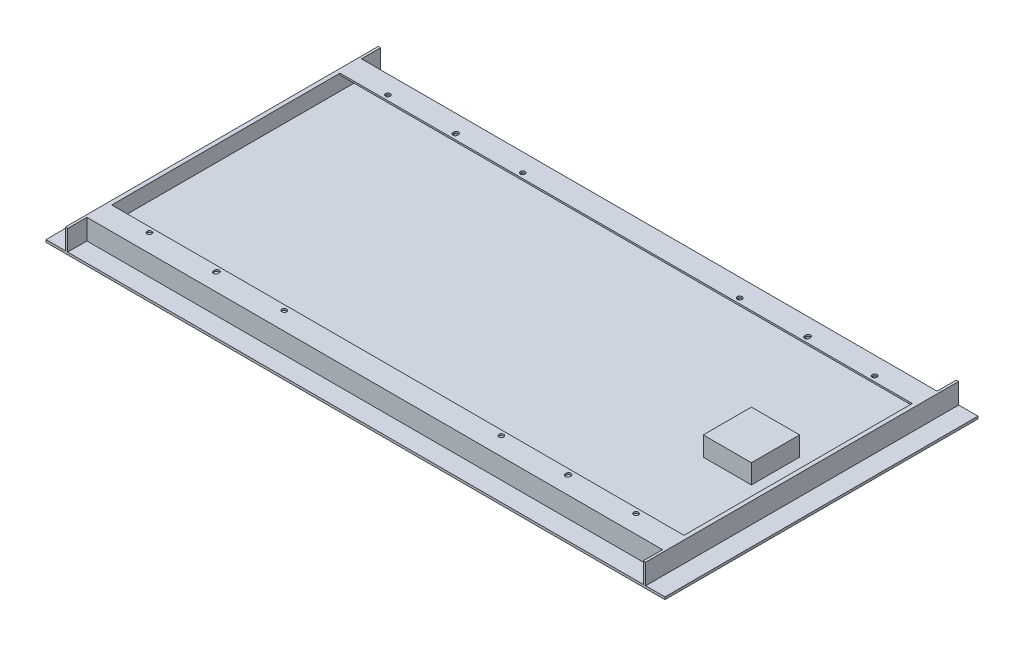
from build123d import *

# Parameters (mm, degrees)
SKETCH1_W            = 754.38
SKETCH1_H            = 351.155
BOSS_EXTRUDE1_DEPTH  = 9.525
SKETCH5_W            = 355.6
SKETCH5_H            = 30.1625
BOSS_EXTRUDE4_DEPTH  = 2.2225
SKETCH6_W            = 754.38
SKETCH6_H            = 30.1625
BOSS_EXTRUDE5_DEPTH  = 2.2225
SKETCH8_W            = 754.38
SKETCH8_H            = 30.1625
BOSS_EXTRUDE6_DEPTH  = 2.2225
SKETCH14_W           = 355.6
SKETCH14_H           = 30.1625
BOSS_EXTRUDE7_DEPTH  = 2.2225
SKETCH16_W           = 754.38
SKETCH16_H           = 2.2225
BOSS_EXTRUDE8_DEPTH  = 25.0825
SKETCH17_W           = 754.38
SKETCH17_H           = 2.2225
BOSS_EXTRUDE9_DEPTH  = 25.0825
CUT_EXTRUDE1_DEPTH   = 2.2225
SKETCH21_R           = 3.175
CUT_EXTRUDE3_DEPTH   = 2.2225
SKETCH22_W           = 758.825
SKETCH22_H           = 30.1625
BOSS_EXTRUDE10_DEPTH = 3.175
SKETCH23_W           = 758.825
SKETCH23_H           = 3.175
BOSS_EXTRUDE11_DEPTH = 25.4
SKETCH24_W           = 758.825
SKETCH24_H           = 30.1625
BOSS_EXTRUDE12_DEPTH = 3.175
SKETCH25_W           = 758.825
SKETCH25_H           = 3.175
BOSS_EXTRUDE13_DEPTH = 25.4
SKETCH26_W           = 412.75
SKETCH26_H           = 30.1625
BOSS_EXTRUDE14_DEPTH = 3.175
SKETCH27_W           = 412.75
SKETCH27_H           = 3.175
BOSS_EXTRUDE15_DEPTH = 25.4
SKETCH28_W           = 412.75
SKETCH28_H           = 30.1625
BOSS_EXTRUDE16_DEPTH = 3.175
SKETCH29_W           = 412.75
SKETCH29_H           = 3.175
BOSS_EXTRUDE17_DEPTH = 25.4
SKETCH30_W           = 63.5
SKETCH30_H           = 63.5
BOSS_EXTRUDE18_DEPTH = 25.4


with BuildPart() as part:
    # Sketch1 → Boss-Extrude1 (new body)
    with BuildSketch(Plane(origin=(0, 0, 0), x_dir=(1, 0, 0), z_dir=(0, 1, 0))):
        Rectangle(SKETCH1_W, SKETCH1_H)
    extrude(amount=BOSS_EXTRUDE1_DEPTH)

    # Sketch5 → Boss-Extrude4 (add)
    with BuildSketch(Plane.ZY.offset(377.19)):
        with Locations((0, 15.08125)):
            Rectangle(SKETCH5_W, SKETCH5_H)
    extrude(amount=BOSS_EXTRUDE4_DEPTH)

    # Sketch6 → Boss-Extrude5 (add)
    with BuildSketch(Plane.XY.offset(175.5775)):
        with Locations((0, 15.08125)):
            Rectangle(SKETCH6_W, SKETCH6_H)
    extrude(amount=BOSS_EXTRUDE5_DEPTH)

    # Sketch8 → Boss-Extrude6 (add)
    with BuildSketch(Plane(origin=(0, 0, -175.5775), x_dir=(-1, 0, 0), z_dir=(0, 0, -1))):
        with Locations((0, 15.08125)):
            Rectangle(SKETCH8_W, SKETCH8_H)
    extrude(amount=BOSS_EXTRUDE6_DEPTH)

    # Sketch14 → Boss-Extrude7 (add)
    with BuildSketch(Plane(origin=(377.19, 0, 0), x_dir=(0, 0, -1), z_dir=(1, 0, 0))):
        with Locations((0, 15.08125)):
            Rectangle(SKETCH14_W, SKETCH14_H)
    extrude(amount=BOSS_EXTRUDE7_DEPTH)

    # Sketch16 → Boss-Extrude8 (add)
    with BuildSketch(Plane.XY.offset(-175.5775)):
        with Locations((0, 29.05125)):
            Rectangle(SKETCH16_W, SKETCH16_H)
    extrude(amount=BOSS_EXTRUDE8_DEPTH)

    # Sketch17 → Boss-Extrude9 (add)
    with BuildSketch(Plane(origin=(0, 0, 175.5775), x_dir=(-1, 0, 0), z_dir=(0, 0, -1))):
        with Locations((0, 29.05125)):
            Rectangle(SKETCH17_W, SKETCH17_H)
    extrude(amount=BOSS_EXTRUDE9_DEPTH)

    # Sketch19 → Cut-Extrude1 (cut)
    with BuildSketch(Plane(origin=(0, 30.1625, 0), x_dir=(1, 0, 0), z_dir=(0, 1, 0))):
        with BuildLine():
            Line((-228.727, 157.1625), (-228.727, 158.4325))
            ThreePointArc((-228.727, 158.4325), (-231.902, 161.6075), (-235.077, 158.4325))
            Line((-235.077, 158.4325), (-235.077, 157.1625))
            ThreePointArc((-235.077, 157.1625), (-231.902, 153.9875), (-228.727, 157.1625))
        make_face()
        with BuildLine():
            Line((-235.077, -158.4325), (-235.077, -157.1625))
            ThreePointArc((-235.077, -157.1625), (-231.902, -153.9875), (-228.727, -157.1625))
            Line((-228.727, -157.1625), (-228.727, -158.4325))
            ThreePointArc((-228.727, -158.4325), (-231.902, -161.6075), (-235.077, -158.4325))
        make_face()
        with BuildLine():
            Line((228.727, -157.1625), (228.727, -158.4325))
            ThreePointArc((228.727, -158.4325), (231.902, -161.6075), (235.077, -158.4325))
            Line((235.077, -158.4325), (235.077, -157.1625))
            ThreePointArc((235.077, -157.1625), (231.902, -153.9875), (228.727, -157.1625))
        make_face()
        with BuildLine():
            Line((228.727, 157.1625), (228.727, 158.4325))
            ThreePointArc((228.727, 158.4325), (231.902, 161.6075), (235.077, 158.4325))
            Line((235.077, 158.4325), (235.077, 157.1625))
            ThreePointArc((235.077, 157.1625), (231.902, 153.9875), (228.727, 157.1625))
        make_face()
    extrude(amount=-CUT_EXTRUDE1_DEPTH, mode=Mode.SUBTRACT)

    # Sketch21 → Cut-Extrude3 (cut)
    with BuildSketch(Plane(origin=(0, 30.1625, 0), x_dir=(1, 0, 0), z_dir=(0, 1, 0))):
        with Locations(Location((-143.002, -157.1625, 0), (0, 0, 270))):
            Circle(SKETCH21_R)
        with Locations(Location((-143.002, 157.1625, 0), (0, 0, 270))):
            Circle(SKETCH21_R)
        with Locations(Location((-320.802, -157.1625, 0), (0, 0, 270))):
            Circle(SKETCH21_R)
        with Locations(Location((-320.802, 157.1625, 0), (0, 0, 270))):
            Circle(SKETCH21_R)
        with Locations(Location((143.002, 157.1625, 0), (0, 0, 270))):
            Circle(SKETCH21_R)
        with Locations(Location((320.802, 157.1625, 0), (0, 0, 270))):
            Circle(SKETCH21_R)
        with Locations(Location((143.002, -157.1625, 0), (0, 0, 270))):
            Circle(SKETCH21_R)
        with Locations(Location((320.802, -157.1625, 0), (0, 0, 270))):
            Circle(SKETCH21_R)
    extrude(amount=-CUT_EXTRUDE3_DEPTH, mode=Mode.SUBTRACT)

    # Sketch22 → Boss-Extrude10 (add)
    with BuildSketch(Plane.XY.offset(177.8)):
        with Locations((0, 15.08125)):
            Rectangle(SKETCH22_W, SKETCH22_H)
    extrude(amount=BOSS_EXTRUDE10_DEPTH)

    # Sketch23 → Boss-Extrude11 (add)
    with BuildSketch(Plane.XY.offset(180.975)):
        with Locations((0, 1.5875)):
            Rectangle(SKETCH23_W, SKETCH23_H)
    extrude(amount=BOSS_EXTRUDE11_DEPTH)

    # Sketch24 → Boss-Extrude12 (add)
    with BuildSketch(Plane(origin=(0, 0, -177.8), x_dir=(-1, 0, 0), z_dir=(0, 0, -1))):
        with Locations((0, 15.08125)):
            Rectangle(SKETCH24_W, SKETCH24_H)
    extrude(amount=BOSS_EXTRUDE12_DEPTH)

    # Sketch25 → Boss-Extrude13 (add)
    with BuildSketch(Plane(origin=(0, 0, -180.975), x_dir=(-1, 0, 0), z_dir=(0, 0, -1))):
        with Locations((0, 1.5875)):
            Rectangle(SKETCH25_W, SKETCH25_H)
    extrude(amount=BOSS_EXTRUDE13_DEPTH)

    # Sketch26 → Boss-Extrude14 (add)
    with BuildSketch(Plane.ZY.offset(379.4125)):
        with Locations((0, 15.08125)):
            Rectangle(SKETCH26_W, SKETCH26_H)
    extrude(amount=BOSS_EXTRUDE14_DEPTH)

    # Sketch27 → Boss-Extrude15 (add)
    with BuildSketch(Plane.ZY.offset(382.5875)):
        with Locations((0, 1.5875)):
            Rectangle(SKETCH27_W, SKETCH27_H)
    extrude(amount=BOSS_EXTRUDE15_DEPTH)

    # Sketch28 → Boss-Extrude16 (add)
    with BuildSketch(Plane(origin=(379.4125, 0, 0), x_dir=(0, 0, -1), z_dir=(1, 0, 0))):
        with Locations((0, 15.08125)):
            Rectangle(SKETCH28_W, SKETCH28_H)
    extrude(amount=BOSS_EXTRUDE16_DEPTH)

    # Sketch29 → Boss-Extrude17 (add)
    with BuildSketch(Plane(origin=(382.5875, 0, 0), x_dir=(0, 0, -1), z_dir=(1, 0, 0))):
        with Locations((0, 1.5875)):
            Rectangle(SKETCH29_W, SKETCH29_H)
    extrude(amount=BOSS_EXTRUDE17_DEPTH)

    # Sketch30 → Boss-Extrude18 (add)
    with BuildSketch(Plane(origin=(0, 9.525, 0), x_dir=(1, 0, 0), z_dir=(0, 1, 0))):
        with Locations((311.785, 3.861461092)):
            Rectangle(SKETCH30_W, SKETCH30_H)
    extrude(amount=BOSS_EXTRUDE18_DEPTH)


solid = part.part
